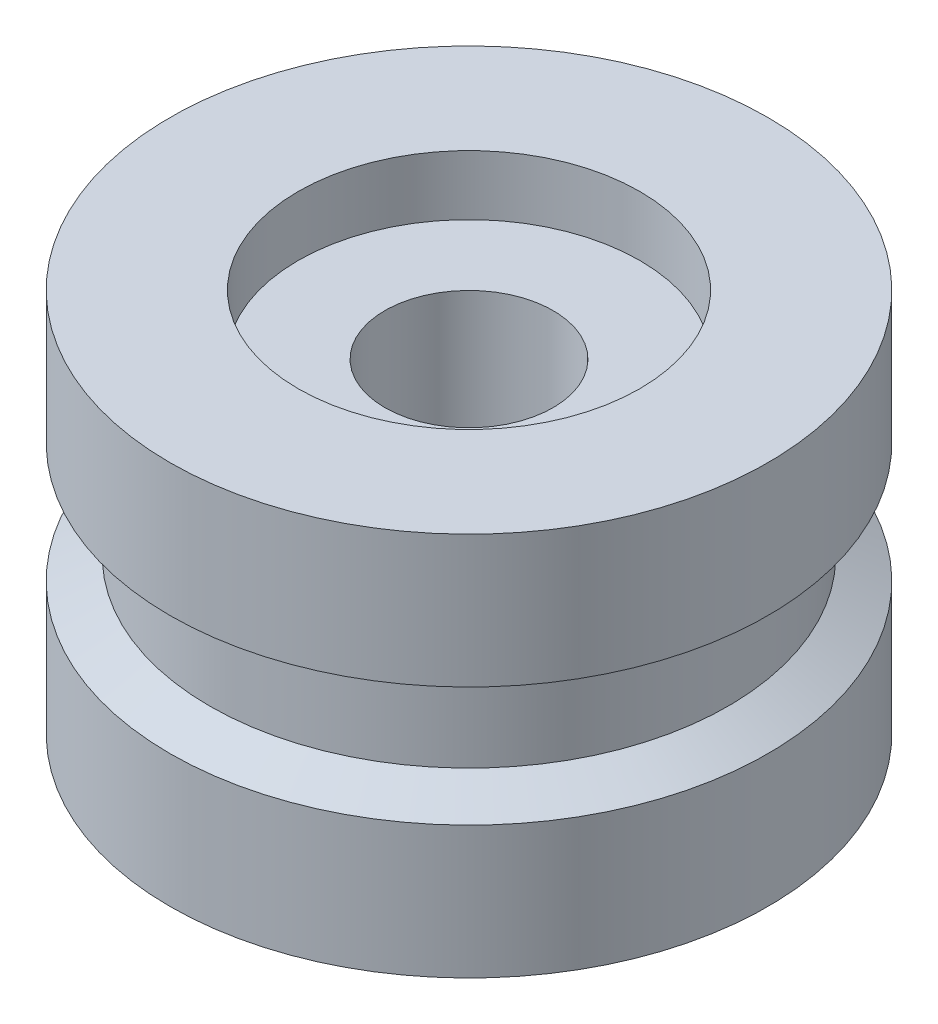
from build123d import *

# Parameters (mm, degrees)
CROQUIS1_R              = 35
CROQUIS1_R_2            = 9.85
SALIENTE_EXTRUIR1_DEPTH = 15.5
CROQUIS3_W              = 15
CROQUIS3_H              = 7


with BuildPart() as part:
    # Croquis1 → Saliente-Extruir1 (new, symmetric)
    with BuildSketch(Plane(origin=(0, 0, 0), x_dir=(1, 0, 0), z_dir=(0, 1, 0))):
        with Locations(Location((0, 0, 0), (0, 0, 270))):
            Circle(CROQUIS1_R)
        with Locations(Location((0, 0, 0), (0, 0, 270))):
            Circle(CROQUIS1_R_2, mode=Mode.SUBTRACT)
    extrude(amount=SALIENTE_EXTRUIR1_DEPTH, both=True)

    # Croquis2 → Cortar-Revolución1 (revolve, cut)
    with BuildSketch(Plane(origin=(0, 0, 0), x_dir=(0, 0, -1), z_dir=(1, 0, 0))):
        Polygon((-30.36, -4.5), (-35, -7), (-35, 7), (-30.36, 4.5), align=None)
    revolve(axis=Axis((0, 15.5, 0), (0, -1, 0)), mode=Mode.SUBTRACT)

    # Croquis3 → Revolución1 (revolve)
    with BuildSketch(Plane(origin=(0, 0, 0), x_dir=(0, 0, -1), z_dir=(1, 0, 0))):
        with Locations((-27.5, 19)):
            Rectangle(CROQUIS3_W, CROQUIS3_H)
        with Locations((-27.5, -19)):
            Rectangle(CROQUIS3_W, CROQUIS3_H)
    revolve(axis=Axis((0, 15.5, 0), (0, -1, 0)))


solid = part.part
